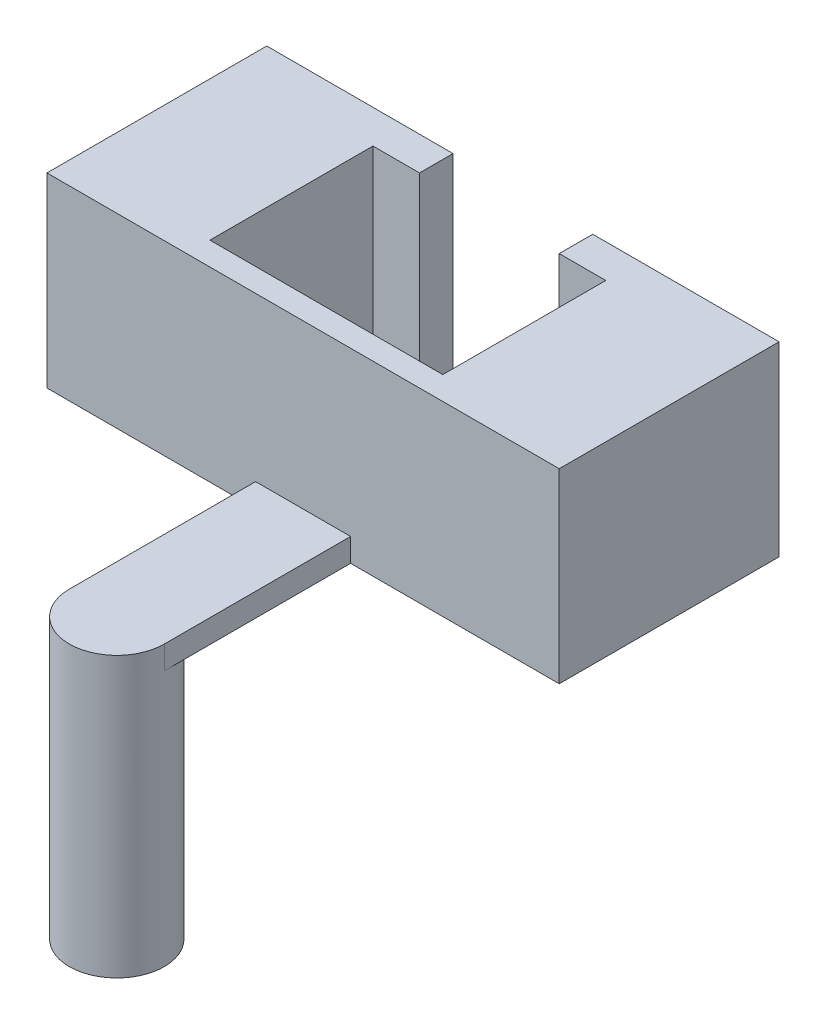
from build123d import *

# Parameters (mm, degrees)
SKETCH1_R           = 12.954
BOSS_EXTRUDE1_DEPTH = 76.2
SKETCH3_W           = 25.908
SKETCH3_H           = 50.8
BOSS_EXTRUDE3_DEPTH = 6.35
SKETCH7_W           = 63.5
SKETCH7_H           = 50.8
BOSS_EXTRUDE4_DEPTH = 6.35
SKETCH10_W          = 38.1
SKETCH10_H          = 50.8
BOSS_EXTRUDE6_DEPTH = 50.8
SKETCH11_W          = 50.8
SKETCH11_H          = 50.8
BOSS_EXTRUDE7_DEPTH = 9.144


with BuildPart() as part:
    # Sketch1 → Boss-Extrude1 (new body)
    with BuildSketch(Plane(origin=(0, 0, 0), x_dir=(1, 0, 0), z_dir=(0, 1, 0))):
        with Locations(Location((-1.734112165, 7.707165176, 0), (0, 0, 90))):
            Circle(SKETCH1_R)
    extrude(amount=BOSS_EXTRUDE1_DEPTH)

    # Sketch3 → Boss-Extrude3 (add)
    with BuildSketch(Plane(origin=(0, 76.2, 0), x_dir=(1, 0, 0), z_dir=(0, 1, 0))):
        with Locations((-1.734112165, 33.107165176)):
            Rectangle(SKETCH3_W, SKETCH3_H)
    extrude(amount=-BOSS_EXTRUDE3_DEPTH)

    # Sketch7 → Boss-Extrude4 (add)
    with BuildSketch(Plane(origin=(0, 0, -58.507165176), x_dir=(-1, 0, 0), z_dir=(0, 0, -1))):
        with Locations((1.734112165, 95.25)):
            Rectangle(SKETCH7_W, SKETCH7_H)
    extrude(amount=BOSS_EXTRUDE4_DEPTH)

    # Sketch10 → Boss-Extrude6 (add)
    with BuildSketch(Plane.XZ.offset(-69.85)):
        with Locations((-52.534112165, -83.907165176)):
            Rectangle(SKETCH10_W, SKETCH10_H)
        with Locations((49.065887835, -83.907165176)):
            Rectangle(SKETCH10_W, SKETCH10_H)
    extrude(amount=-BOSS_EXTRUDE6_DEPTH)

    # Sketch11 → Boss-Extrude7 (add)
    with BuildSketch(Plane(origin=(0, 0, -109.307165176), x_dir=(-1, 0, 0), z_dir=(0, 0, -1))):
        with Locations((-42.715887835, 95.25)):
            Rectangle(SKETCH11_W, SKETCH11_H)
        with Locations((46.184112165, 95.25)):
            Rectangle(SKETCH11_W, SKETCH11_H)
    extrude(amount=BOSS_EXTRUDE7_DEPTH)


solid = part.part
